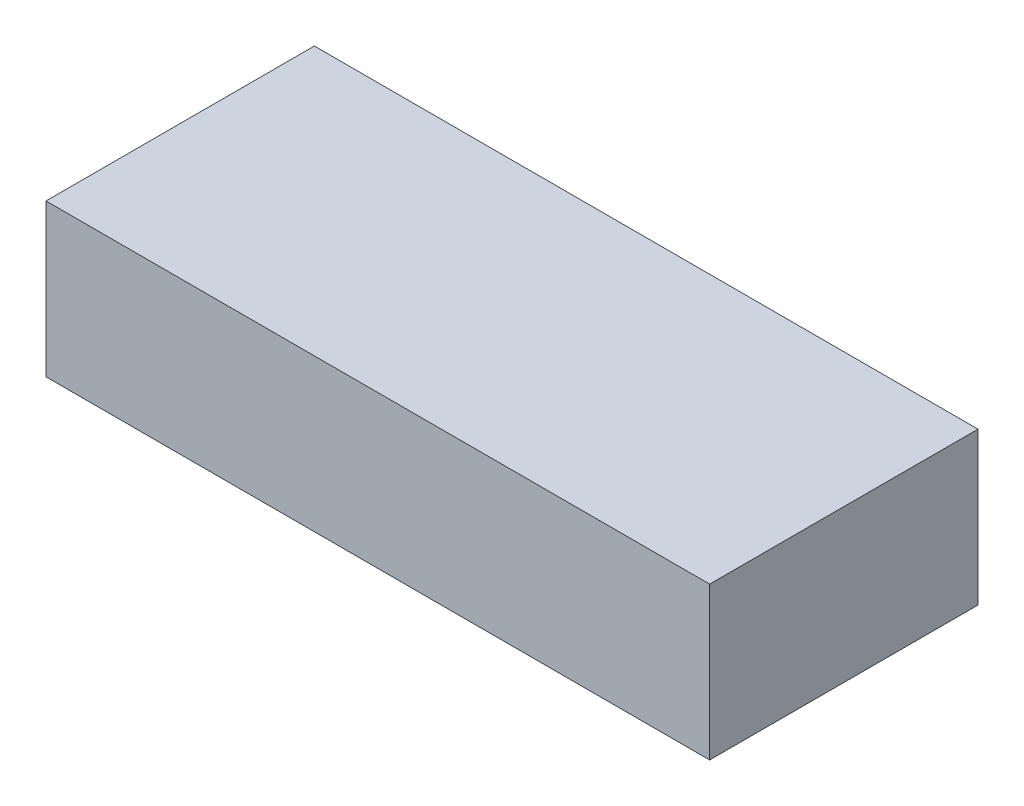
from build123d import *

# Parameters (mm, degrees)
SKETCH1_W           = 915
SKETCH1_H           = 370
BOSS_EXTRUDE1_DEPTH = 210


with BuildPart() as part:
    # Sketch1 → Boss-Extrude1 (new body)
    with BuildSketch(Plane(origin=(0, 0, 0), x_dir=(1, 0, 0), z_dir=(0, 1, 0))):
        with Locations((0, 185)):
            Rectangle(SKETCH1_W, SKETCH1_H)
    extrude(amount=-BOSS_EXTRUDE1_DEPTH)


solid = part.part
